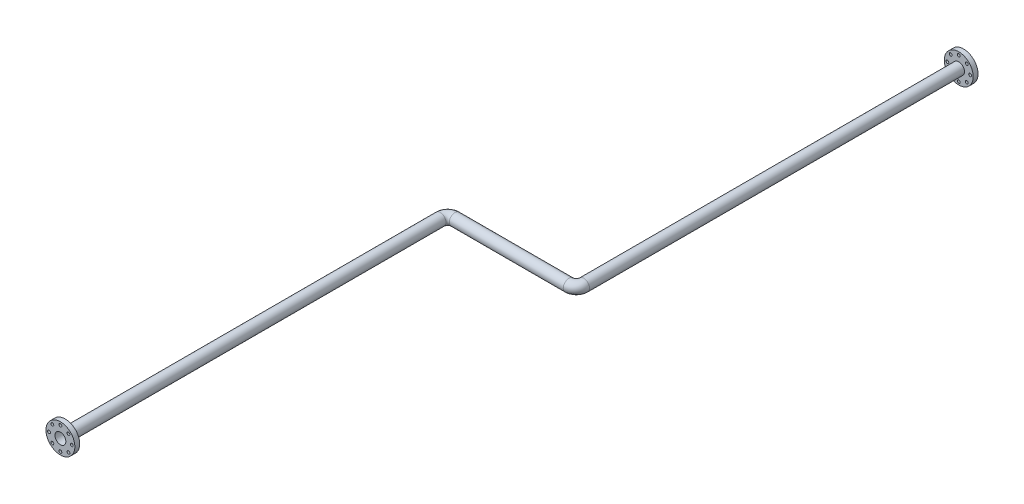
from build123d import *

# Parameters (mm, degrees)
SKETCH_1_R      = 30.25
SKETCH_1_R_2    = 28.65
EXTRUDE_1_DEPTH = 300
SKETCH_2_R      = 30.25
SKETCH_2_R_2    = 28.65
REVOLVE_1_ANGLE = 90
SKETCH_3_R      = 30.25
SKETCH_3_R_2    = 28.65
REVOLVE_2_ANGLE = 90
SKETCH_4_R      = 30.25
SKETCH_4_R_2    = 28.65
EXTRUDE_2_DEPTH = 2000
SKETCH_5_R      = 30.25
SKETCH_5_R_2    = 28.65
EXTRUDE_3_DEPTH = 2000
EXTRUDE_START   = -25.5
SKETCH_6_R      = 76
SKETCH_6_R_2    = 28.65
SKETCH_6_R_3    = 7.5
EXTRUDE_4_DEPTH = 25.5
SKETCH_7_R      = 76
SKETCH_7_R_2    = 28.65
SKETCH_7_R_3    = 7.5
EXTRUDE_5_DEPTH = 25.5


with BuildPart() as part:
    # 스케치1 → 보스-돌출1 (new, symmetric)
    with BuildSketch(Plane(origin=(0, 0, 0), x_dir=(0, 0, -1), z_dir=(1, 0, 0))):
        Circle(SKETCH_1_R)
        Circle(SKETCH_1_R_2, mode=Mode.SUBTRACT)
    extrude(amount=EXTRUDE_1_DEPTH, both=True)

    # 스케치2 → 회전1 (revolve)
    with BuildSketch(Plane(origin=(300, 0, 0), x_dir=(0, 0, -1), z_dir=(1, 0, 0))):
        with Locations(Location((0, 0, 0), (0, 0, 180))):
            Circle(SKETCH_2_R)
        with Locations(Location((0, 0, 0), (0, 0, 180))):
            Circle(SKETCH_2_R_2, mode=Mode.SUBTRACT)
    revolve(axis=Axis((300, 37.728915397, -39), (0, 1, 0)), revolution_arc=REVOLVE_1_ANGLE)

    # 스케치3 → 회전2 (revolve)
    with BuildSketch(Plane.ZY.offset(300)):
        Circle(SKETCH_3_R)
        Circle(SKETCH_3_R_2, mode=Mode.SUBTRACT)
    revolve(axis=Axis((-300, 42.165716668, 39), (0, 1, 0)), revolution_arc=REVOLVE_2_ANGLE)

    # 스케치4 → 보스-돌출2 (add)
    with BuildSketch(Plane(origin=(0, 0, -39), x_dir=(-1, 0, 0), z_dir=(0, 0, -1))):
        with Locations(Location((-339, 0, 0), (0, 0, 180))):
            Circle(SKETCH_4_R)
        with Locations(Location((-339, 0, 0), (0, 0, 180))):
            Circle(SKETCH_4_R_2, mode=Mode.SUBTRACT)
    extrude(amount=EXTRUDE_2_DEPTH)

    # 스케치5 → 보스-돌출3 (add)
    with BuildSketch(Plane.XY.offset(39)):
        with Locations(Location((-339, 0, 0), (0, 0, 180))):
            Circle(SKETCH_5_R)
        with Locations(Location((-339, 0, 0), (0, 0, 180))):
            Circle(SKETCH_5_R_2, mode=Mode.SUBTRACT)
    extrude(amount=EXTRUDE_3_DEPTH)

    # 스케치6 → 보스-돌출4 (add)
    with BuildSketch(Plane.XY.offset(2039).offset(EXTRUDE_START)):
        with Locations((-339, 0)):
            Circle(SKETCH_6_R)
        with Locations(Location((-339, 0, 0), (0, 0, 180))):
            Circle(SKETCH_6_R_2, mode=Mode.SUBTRACT)
        with Locations((-339, 60)):
            Circle(SKETCH_6_R_3, mode=Mode.SUBTRACT)
        with Locations((-296.573593129, 42.426406871)):
            Circle(SKETCH_6_R_3, mode=Mode.SUBTRACT)
        with Locations((-279, 0)):
            Circle(SKETCH_6_R_3, mode=Mode.SUBTRACT)
        with Locations((-296.573593129, -42.426406871)):
            Circle(SKETCH_6_R_3, mode=Mode.SUBTRACT)
        with Locations((-339, -60)):
            Circle(SKETCH_6_R_3, mode=Mode.SUBTRACT)
        with Locations((-381.426406871, -42.426406871)):
            Circle(SKETCH_6_R_3, mode=Mode.SUBTRACT)
        with Locations((-399, 0)):
            Circle(SKETCH_6_R_3, mode=Mode.SUBTRACT)
        with Locations((-381.426406871, 42.426406871)):
            Circle(SKETCH_6_R_3, mode=Mode.SUBTRACT)
    extrude(amount=EXTRUDE_4_DEPTH)

    # 스케치7 → 보스-돌출5 (add)
    with BuildSketch(Plane(origin=(0, 0, -2039), x_dir=(-1, 0, 0), z_dir=(0, 0, -1)).offset(EXTRUDE_START)):
        with Locations((-339, 0)):
            Circle(SKETCH_7_R)
        with Locations(Location((-339, 0, 0), (0, 0, 180))):
            Circle(SKETCH_7_R_2, mode=Mode.SUBTRACT)
        with Locations((-339, 60)):
            Circle(SKETCH_7_R_3, mode=Mode.SUBTRACT)
        with Locations((-296.573593129, 42.426406871)):
            Circle(SKETCH_7_R_3, mode=Mode.SUBTRACT)
        with Locations((-279, 0)):
            Circle(SKETCH_7_R_3, mode=Mode.SUBTRACT)
        with Locations((-296.573593129, -42.426406871)):
            Circle(SKETCH_7_R_3, mode=Mode.SUBTRACT)
        with Locations((-339, -60)):
            Circle(SKETCH_7_R_3, mode=Mode.SUBTRACT)
        with Locations((-381.426406871, -42.426406871)):
            Circle(SKETCH_7_R_3, mode=Mode.SUBTRACT)
        with Locations((-399, 0)):
            Circle(SKETCH_7_R_3, mode=Mode.SUBTRACT)
        with Locations((-381.426406871, 42.426406871)):
            Circle(SKETCH_7_R_3, mode=Mode.SUBTRACT)
    extrude(amount=EXTRUDE_5_DEPTH)


solid = part.part
